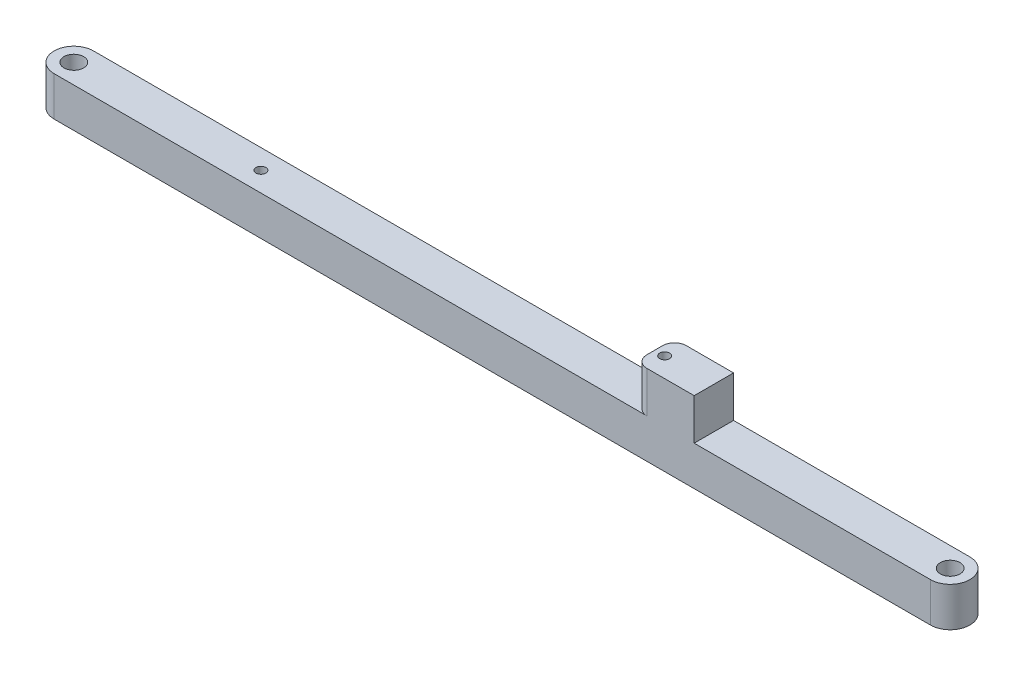
from build123d import *

# Parameters (mm, degrees)
SKETCH2_R           = 6.35
SKETCH2_R_2         = 3.175
BOSS_EXTRUDE1_DEPTH = 25.4
SKETCH14_W          = 38.1
SKETCH14_H          = 25.4
BOSS_EXTRUDE2_DEPTH = 26.543
SKETCH15_R          = 3.175
CUT_EXTRUDE1_DEPTH  = 19.05
FILLET1_R           = 7.62


with BuildPart() as part:
    # Sketch2 → Boss-Extrude1 (new body)
    with BuildSketch(Plane(origin=(0, 0, 0), x_dir=(1, 0, 0), z_dir=(0, 1, 0))):
        with BuildLine():
            ThreePointArc((0, 25.4), (-12.7, 12.7), (0, 0))
            Line((0, 0), (565.15, 0))
            ThreePointArc((565.15, 0), (577.85, 12.7), (565.15, 25.4))
            Line((565.15, 25.4), (0, 25.4))
        make_face()
        with Locations(Location((0, 12.7, 0), (0, 0, 270))):
            Circle(SKETCH2_R, mode=Mode.SUBTRACT)
        with Locations(Location((120.65, 12.7, 0), (0, 0, 270))):
            Circle(SKETCH2_R_2, mode=Mode.SUBTRACT)
        with Locations(Location((565.15, 12.7, 0), (0, 0, 270))):
            Circle(SKETCH2_R, mode=Mode.SUBTRACT)
    extrude(amount=BOSS_EXTRUDE1_DEPTH)

    # Sketch14 → Boss-Extrude2 (add)
    with BuildSketch(Plane(origin=(0, 25.4, 0), x_dir=(1, 0, 0), z_dir=(0, 1, 0))):
        with Locations((393.7, 12.7)):
            Rectangle(SKETCH14_W, SKETCH14_H)
    extrude(amount=BOSS_EXTRUDE2_DEPTH)

    # Sketch15 → Cut-Extrude1 (cut)
    with BuildSketch(Plane(origin=(0, 51.943, 0), x_dir=(1, 0, 0), z_dir=(0, 1, 0))):
        with Locations(Location((381, 12.7, 0), (0, 0, 270))):
            Circle(SKETCH15_R)
    extrude(amount=-CUT_EXTRUDE1_DEPTH, mode=Mode.SUBTRACT)

    # Fillet1
    fillet1_edges = [part.edges().sort_by_distance(p)[0] for p in [
        (374.65, 38.6715, 0),
        (374.65, 38.6715, -25.4),
    ]]
    fillet(fillet1_edges, radius=FILLET1_R)


solid = part.part
